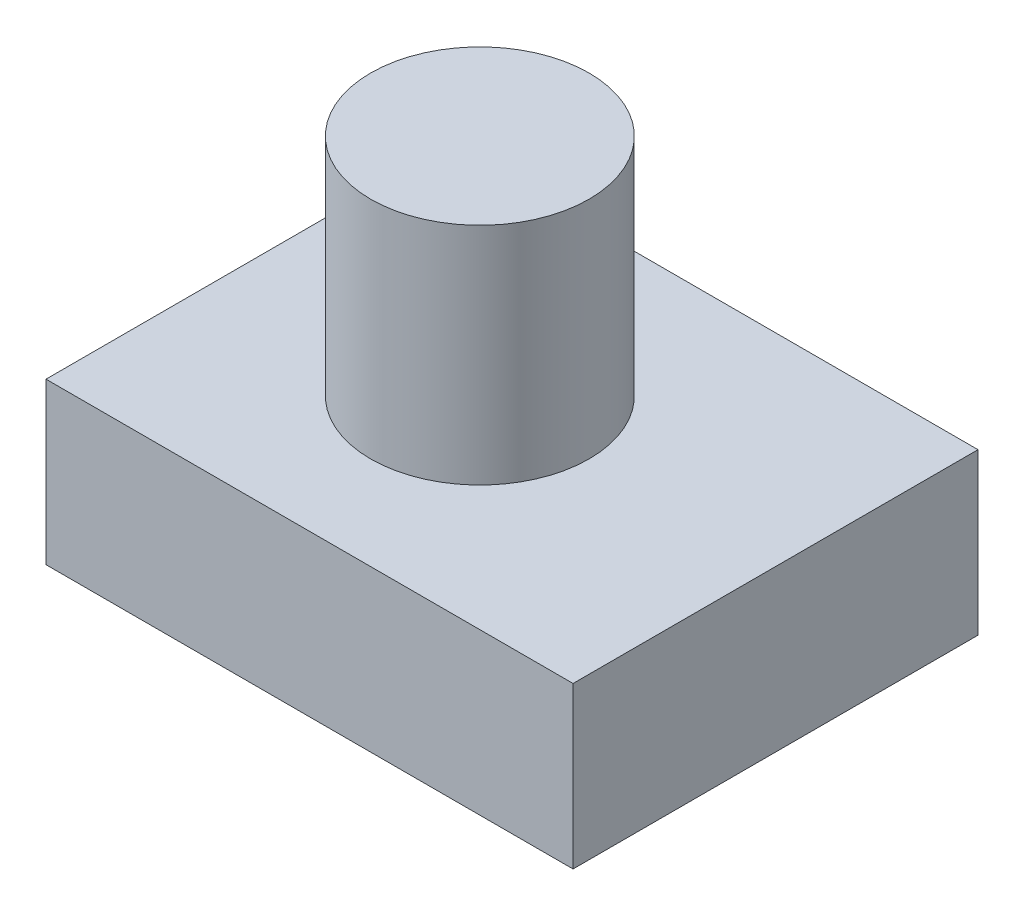
from build123d import *

# Parameters (mm, degrees)
SKETCH1_W           = 82
SKETCH1_H           = 63
BOSS_EXTRUDE1_DEPTH = 25
SKETCH2_R           = 17
BOSS_EXTRUDE2_DEPTH = 35
SCALE1_SCALE        = 0.1


with BuildPart() as part:
    # Sketch1 → Boss-Extrude1 (new body)
    with BuildSketch(Plane(origin=(0, 0, 0), x_dir=(1, 0, 0), z_dir=(0, 1, 0))):
        with Locations((2.928571429, -13.287946429)):
            Rectangle(SKETCH1_W, SKETCH1_H)
    extrude(amount=BOSS_EXTRUDE1_DEPTH)

    # Sketch2 → Boss-Extrude2 (add)
    with BuildSketch(Plane(origin=(0, 25, 0), x_dir=(1, 0, 0), z_dir=(0, 1, 0))):
        with Locations(Location((-2.071428571, -13.287946429, 0), (0, 0, 270))):
            Circle(SKETCH2_R)
    extrude(amount=BOSS_EXTRUDE2_DEPTH)


with BuildPart() as part_1:
    # Scale1: scaled about (1.941255183, 18.423897472, 13.287946429)
    add(part.part.scale(SCALE1_SCALE).moved(Location((1.747129665, 16.581507725, 11.959151786))))


solid = part_1.part
